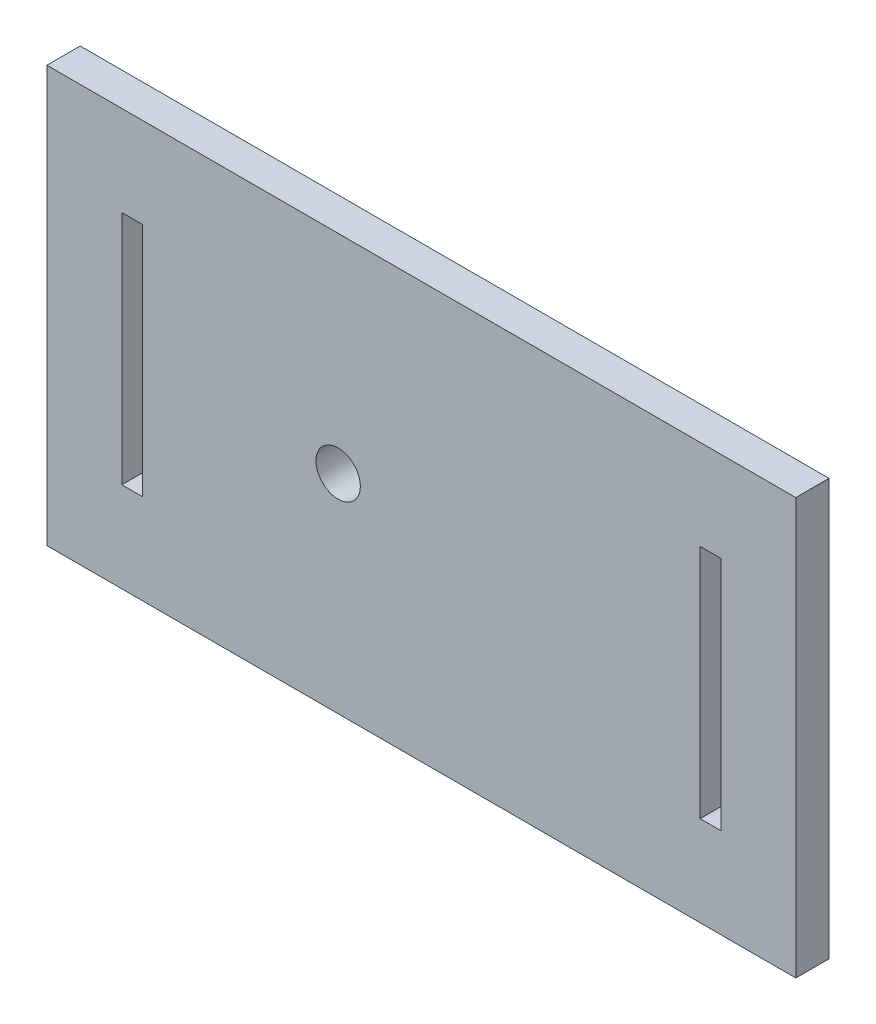
from build123d import *

# Parameters (mm, degrees)
SKETCH1_W           = 54
SKETCH1_H           = 30
SKETCH1_W_2         = 1.5
SKETCH1_H_2         = 17
SKETCH1_R           = 1.6
BOSS_EXTRUDE1_DEPTH = 2.4


with BuildPart() as part:
    # Sketch1 → Boss-Extrude1 (new body)
    with BuildSketch(Plane.XY):
        Rectangle(SKETCH1_W, SKETCH1_H)
        with Locations((-20.85, 0)):
            Rectangle(SKETCH1_W_2, SKETCH1_H_2, mode=Mode.SUBTRACT)
        with Locations((20.85, 0)):
            Rectangle(SKETCH1_W_2, SKETCH1_H_2, mode=Mode.SUBTRACT)
        with Locations((-6, 0)):
            Circle(SKETCH1_R, mode=Mode.SUBTRACT)
    extrude(amount=BOSS_EXTRUDE1_DEPTH)


solid = part.part
